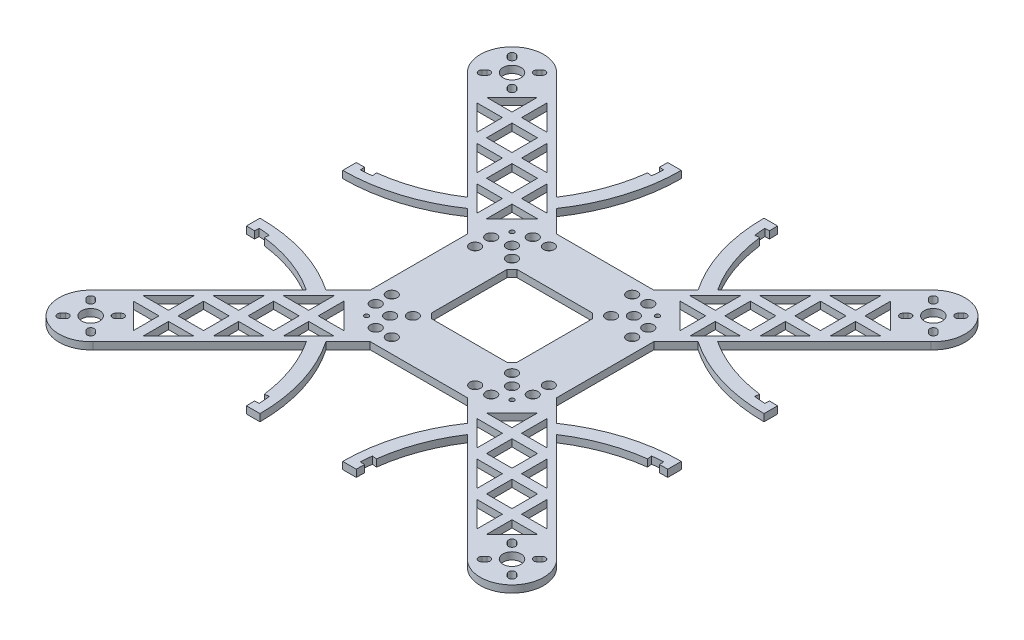
from build123d import *

# Parameters (mm, degrees)
SKETCH1_W                              = 82.58
SKETCH1_H                              = 82.58
CENTER_SQUARE_DEPTH                    = 3.175
SKETCH2_W                              = 37.87
SKETCH2_H                              = 37.87
SQUARE_HOLE_DEPTH                      = 3.175
SKETCH3_R                              = 2.375
POWER_BOARD_MOUNTING_HOLES_DEPTH       = 3.175
SQUARE_HOLE_DIAGONALS_DEPTH            = 3.175
SKETCH5_R                              = 1
ELECTRONICS_BOARD_MOUNTING_HOLES_DEPTH = 59.479131534
SKETCH6_R                              = 2.375
IR_SENSOR_MOUNTING_HOLES_DEPTH         = 59.479131534
PROPELLER_ARMS_DEPTH                   = 3.175
SKETCH8_R                              = 4
MOTOR_MOUNTING_HOLES_DEPTH             = 152.812368981
SKETCH10_W                             = 11.289276357
SKETCH10_H                             = 11.289276357
ARM_CROSS_HATCHING_DEPTH               = 152.812368981
GUARD_RINGS_DEPTH                      = 3.175


with BuildPart() as part:
    # Sketch1 → Center Square (new body)
    with BuildSketch(Plane(origin=(0, 0, 0), x_dir=(1, 0, 0), z_dir=(0, 1, 0))):
        Rectangle(SKETCH1_W, SKETCH1_H)
    extrude(amount=CENTER_SQUARE_DEPTH)

    # Sketch2 → Square Hole (cut)
    with BuildSketch(Plane(origin=(0, 3.175, 0), x_dir=(1, 0, 0), z_dir=(0, 1, 0))):
        Rectangle(SKETCH2_W, SKETCH2_H)
    extrude(amount=-SQUARE_HOLE_DEPTH, mode=Mode.SUBTRACT)

    # Sketch3 → Power Board Mounting Holes (cut)
    with BuildSketch(Plane(origin=(0, 3.175, 0), x_dir=(1, 0, 0), z_dir=(0, 1, 0))):
        with Locations(Location((21.955, 21.955, 0), (0, 0, 270))):
            Circle(SKETCH3_R)
        with Locations(Location((26.993135816, 26.993135816, 0), (0, 0, 270))):
            Circle(SKETCH3_R)
        with Locations(Location((21.955, -21.955, 0), (0, 0, 270))):
            Circle(SKETCH3_R)
        with Locations(Location((26.993135816, -26.993135816, 0), (0, 0, 270))):
            Circle(SKETCH3_R)
        with Locations(Location((-21.955, -21.955, 0), (0, 0, 270))):
            Circle(SKETCH3_R)
        with Locations(Location((-26.993135816, -26.993135816, 0), (0, 0, 270))):
            Circle(SKETCH3_R)
        with Locations(Location((-21.955, 21.955, 0), (0, 0, 270))):
            Circle(SKETCH3_R)
        with Locations(Location((-26.993135816, 26.993135816, 0), (0, 0, 270))):
            Circle(SKETCH3_R)
    extrude(amount=-POWER_BOARD_MOUNTING_HOLES_DEPTH, mode=Mode.SUBTRACT)

    # Sketch4 → Square Hole Diagonals (add)
    with BuildSketch(Plane(origin=(0, 3.175, 0), x_dir=(1, 0, 0), z_dir=(0, 1, 0))):
        Polygon((16.68993597, 18.935), (18.935, 16.68993597), (18.935, 18.935), align=None)
        Polygon((18.935, -16.68993597), (16.68993597, -18.935), (18.935, -18.935), align=None)
        Polygon((-16.68993597, -18.935), (-18.935, -16.68993597), (-18.935, -18.935), align=None)
        Polygon((-18.935, 16.68993597), (-16.68993597, 18.935), (-18.935, 18.935), align=None)
    extrude(amount=-SQUARE_HOLE_DIAGONALS_DEPTH)

    # Sketch5 → Electronics Board Mounting Holes (cut, through all)
    with BuildSketch(Plane(origin=(0, 3.175, 0), x_dir=(1, 0, 0), z_dir=(0, 1, 0))):
        with Locations(Location((32.22, 32.22, 0), (0, 0, 270))):
            Circle(SKETCH5_R)
        with Locations(Location((32.22, -32.22, 0), (0, 0, 270))):
            Circle(SKETCH5_R)
        with Locations(Location((-32.22, -32.22, 0), (0, 0, 270))):
            Circle(SKETCH5_R)
        with Locations(Location((-32.22, 32.22, 0), (0, 0, 270))):
            Circle(SKETCH5_R)
    extrude(amount=-ELECTRONICS_BOARD_MOUNTING_HOLES_DEPTH, mode=Mode.SUBTRACT)

    # Sketch6 → IR Sensor Mounting Holes (cut, through all)
    with BuildSketch(Plane(origin=(0, 3.175, 0), x_dir=(1, 0, 0), z_dir=(0, 1, 0))):
        with Locations(Location((34.79, 18.46, 0), (0, 0, 270))):
            Circle(SKETCH6_R)
        with Locations(Location((34.79, 25.585, 0), (0, 0, 270))):
            Circle(SKETCH6_R)
        with Locations(Location((34.79, -25.585, 0), (0, 0, 90))):
            Circle(SKETCH6_R)
        with Locations(Location((34.79, -18.46, 0), (0, 0, 90))):
            Circle(SKETCH6_R)
        with Locations(Location((25.585, -34.79, 0), (0, 0, 270))):
            Circle(SKETCH6_R)
        with Locations(Location((18.46, -34.79, 0), (0, 0, 270))):
            Circle(SKETCH6_R)
        with Locations(Location((-18.46, -34.79, 0), (0, 0, 90))):
            Circle(SKETCH6_R)
        with Locations(Location((-25.585, -34.79, 0), (0, 0, 90))):
            Circle(SKETCH6_R)
        with Locations(Location((-34.79, -25.585, 0), (0, 0, 270))):
            Circle(SKETCH6_R)
        with Locations(Location((-34.79, -18.46, 0), (0, 0, 270))):
            Circle(SKETCH6_R)
        with Locations(Location((-34.79, 18.46, 0), (0, 0, 90))):
            Circle(SKETCH6_R)
        with Locations(Location((-34.79, 25.585, 0), (0, 0, 90))):
            Circle(SKETCH6_R)
        with Locations(Location((-25.585, 34.79, 0), (0, 0, 270))):
            Circle(SKETCH6_R)
        with Locations(Location((-18.46, 34.79, 0), (0, 0, 270))):
            Circle(SKETCH6_R)
        with Locations(Location((18.46, 34.79, 0), (0, 0, 90))):
            Circle(SKETCH6_R)
        with Locations(Location((25.585, 34.79, 0), (0, 0, 90))):
            Circle(SKETCH6_R)
    extrude(amount=-IR_SENSOR_MOUNTING_HOLES_DEPTH, mode=Mode.SUBTRACT)

    # Sketch7 → Propeller Arms (add)
    with BuildSketch(Plane(origin=(0, 3.175, 0), x_dir=(1, 0, 0), z_dir=(0, 1, 0))):
        with BuildLine():
            Line((82.94515068, 102.719708411), (21.515442268, 41.29))
            Line((21.515442268, 41.29), (41.29, 41.29))
            Line((41.29, 41.29), (41.29, 21.515442268))
            Line((41.29, 21.515442268), (102.719708411, 82.94515068))
            ThreePointArc((102.719708411, 82.94515068), (103.223571337, 103.223571337), (82.94515068, 102.719708411))
        make_face()
        with BuildLine():
            Line((102.719708411, -82.94515068), (41.29, -21.515442268))
            Line((41.29, -21.515442268), (41.29, -41.29))
            Line((41.29, -41.29), (21.515442268, -41.29))
            Line((21.515442268, -41.29), (82.94515068, -102.719708411))
            ThreePointArc((82.94515068, -102.719708411), (103.223571337, -103.223571337), (102.719708411, -82.94515068))
        make_face()
        with BuildLine():
            Line((-82.94515068, -102.719708411), (-21.515442268, -41.29))
            Line((-21.515442268, -41.29), (-41.29, -41.29))
            Line((-41.29, -41.29), (-41.29, -21.515442268))
            Line((-41.29, -21.515442268), (-102.719708411, -82.94515068))
            ThreePointArc((-102.719708411, -82.94515068), (-103.223571337, -103.223571337), (-82.94515068, -102.719708411))
        make_face()
        with BuildLine():
            Line((-102.719708411, 82.94515068), (-41.29, 21.515442268))
            Line((-41.29, 21.515442268), (-41.29, 41.29))
            Line((-41.29, 41.29), (-21.515442268, 41.29))
            Line((-21.515442268, 41.29), (-82.94515068, 102.719708411))
            ThreePointArc((-82.94515068, 102.719708411), (-103.223571337, 103.223571337), (-102.719708411, 82.94515068))
        make_face()
    extrude(amount=-PROPELLER_ARMS_DEPTH)

    # Sketch8 → Motor Mounting Holes (cut, through all)
    with BuildSketch(Plane(origin=(0, 3.175, 0), x_dir=(1, 0, 0), z_dir=(0, 1, 0))):
        with Locations(Location((93.324076401, 93.324076401, 0), (0, 0, 270))):
            Circle(SKETCH8_R)
        with Locations(Location((93.324076401, -93.324076401, 0), (0, 0, 270))):
            Circle(SKETCH8_R)
        with Locations(Location((-93.324076401, -93.324076401, 0), (0, 0, 270))):
            Circle(SKETCH8_R)
        with Locations(Location((-93.324076401, 93.324076401, 0), (0, 0, 270))):
            Circle(SKETCH8_R)
        with BuildLine():
            Line((97.8495598, 99.970880144), (98.910219972, 101.031540316))
            ThreePointArc((98.910219972, 101.031540316), (101.031540316, 101.031540316), (101.031540316, 98.910219972))
            Line((101.031540316, 98.910219972), (99.970880144, 97.8495598))
            ThreePointArc((99.970880144, 97.8495598), (97.8495598, 97.8495598), (97.8495598, 99.970880144))
        make_face()
        with BuildLine():
            Line((99.970880144, 88.798593001), (101.031540316, 87.737932829))
            ThreePointArc((101.031540316, 87.737932829), (101.031540316, 85.616612486), (98.910219972, 85.616612486))
            Line((98.910219972, 85.616612486), (97.8495598, 86.677272658))
            ThreePointArc((97.8495598, 86.677272658), (97.8495598, 88.798593001), (99.970880144, 88.798593001))
        make_face()
        with BuildLine():
            Line((88.798593001, 86.677272658), (87.737932829, 85.616612486))
            ThreePointArc((87.737932829, 85.616612486), (85.616612486, 85.616612486), (85.616612486, 87.737932829))
            Line((85.616612486, 87.737932829), (86.677272658, 88.798593001))
            ThreePointArc((86.677272658, 88.798593001), (88.798593001, 88.798593001), (88.798593001, 86.677272658))
        make_face()
        with BuildLine():
            Line((86.677272658, 97.8495598), (85.616612486, 98.910219972))
            ThreePointArc((85.616612486, 98.910219972), (85.616612486, 101.031540316), (87.737932829, 101.031540316))
            Line((87.737932829, 101.031540316), (88.798593001, 99.970880144))
            ThreePointArc((88.798593001, 99.970880144), (88.798593001, 97.8495598), (86.677272658, 97.8495598))
        make_face()
        with BuildLine():
            Line((99.970880144, -97.8495598), (101.031540316, -98.910219972))
            ThreePointArc((101.031540316, -98.910219972), (101.031540316, -101.031540316), (98.910219972, -101.031540316))
            Line((98.910219972, -101.031540316), (97.8495598, -99.970880144))
            ThreePointArc((97.8495598, -99.970880144), (97.8495598, -97.8495598), (99.970880144, -97.8495598))
        make_face()
        with BuildLine():
            Line((88.798593001, -99.970880144), (87.737932829, -101.031540316))
            ThreePointArc((87.737932829, -101.031540316), (85.616612486, -101.031540316), (85.616612486, -98.910219972))
            Line((85.616612486, -98.910219972), (86.677272658, -97.8495598))
            ThreePointArc((86.677272658, -97.8495598), (88.798593001, -97.8495598), (88.798593001, -99.970880144))
        make_face()
        with BuildLine():
            Line((86.677272658, -88.798593001), (85.616612486, -87.737932829))
            ThreePointArc((85.616612486, -87.737932829), (85.616612486, -85.616612486), (87.737932829, -85.616612486))
            Line((87.737932829, -85.616612486), (88.798593001, -86.677272658))
            ThreePointArc((88.798593001, -86.677272658), (88.798593001, -88.798593001), (86.677272658, -88.798593001))
        make_face()
        with BuildLine():
            Line((97.8495598, -86.677272658), (98.910219972, -85.616612486))
            ThreePointArc((98.910219972, -85.616612486), (101.031540316, -85.616612486), (101.031540316, -87.737932829))
            Line((101.031540316, -87.737932829), (99.970880144, -88.798593001))
            ThreePointArc((99.970880144, -88.798593001), (97.8495598, -88.798593001), (97.8495598, -86.677272658))
        make_face()
        with BuildLine():
            Line((-97.8495598, -99.970880144), (-98.910219972, -101.031540316))
            ThreePointArc((-98.910219972, -101.031540316), (-101.031540316, -101.031540316), (-101.031540316, -98.910219972))
            Line((-101.031540316, -98.910219972), (-99.970880144, -97.8495598))
            ThreePointArc((-99.970880144, -97.8495598), (-97.8495598, -97.8495598), (-97.8495598, -99.970880144))
        make_face()
        with BuildLine():
            Line((-99.970880144, -88.798593001), (-101.031540316, -87.737932829))
            ThreePointArc((-101.031540316, -87.737932829), (-101.031540316, -85.616612486), (-98.910219972, -85.616612486))
            Line((-98.910219972, -85.616612486), (-97.8495598, -86.677272658))
            ThreePointArc((-97.8495598, -86.677272658), (-97.8495598, -88.798593001), (-99.970880144, -88.798593001))
        make_face()
        with BuildLine():
            Line((-88.798593001, -86.677272658), (-87.737932829, -85.616612486))
            ThreePointArc((-87.737932829, -85.616612486), (-85.616612486, -85.616612486), (-85.616612486, -87.737932829))
            Line((-85.616612486, -87.737932829), (-86.677272658, -88.798593001))
            ThreePointArc((-86.677272658, -88.798593001), (-88.798593001, -88.798593001), (-88.798593001, -86.677272658))
        make_face()
        with BuildLine():
            Line((-86.677272658, -97.8495598), (-85.616612486, -98.910219972))
            ThreePointArc((-85.616612486, -98.910219972), (-85.616612486, -101.031540316), (-87.737932829, -101.031540316))
            Line((-87.737932829, -101.031540316), (-88.798593001, -99.970880144))
            ThreePointArc((-88.798593001, -99.970880144), (-88.798593001, -97.8495598), (-86.677272658, -97.8495598))
        make_face()
        with BuildLine():
            Line((-99.970880144, 97.8495598), (-101.031540316, 98.910219972))
            ThreePointArc((-101.031540316, 98.910219972), (-101.031540316, 101.031540316), (-98.910219972, 101.031540316))
            Line((-98.910219972, 101.031540316), (-97.8495598, 99.970880144))
            ThreePointArc((-97.8495598, 99.970880144), (-97.8495598, 97.8495598), (-99.970880144, 97.8495598))
        make_face()
        with BuildLine():
            Line((-88.798593001, 99.970880144), (-87.737932829, 101.031540316))
            ThreePointArc((-87.737932829, 101.031540316), (-85.616612486, 101.031540316), (-85.616612486, 98.910219972))
            Line((-85.616612486, 98.910219972), (-86.677272658, 97.8495598))
            ThreePointArc((-86.677272658, 97.8495598), (-88.798593001, 97.8495598), (-88.798593001, 99.970880144))
        make_face()
        with BuildLine():
            Line((-86.677272658, 88.798593001), (-85.616612486, 87.737932829))
            ThreePointArc((-85.616612486, 87.737932829), (-85.616612486, 85.616612486), (-87.737932829, 85.616612486))
            Line((-87.737932829, 85.616612486), (-88.798593001, 86.677272658))
            ThreePointArc((-88.798593001, 86.677272658), (-88.798593001, 88.798593001), (-86.677272658, 88.798593001))
        make_face()
        with BuildLine():
            Line((-97.8495598, 86.677272658), (-98.910219972, 85.616612486))
            ThreePointArc((-98.910219972, 85.616612486), (-101.031540316, 85.616612486), (-101.031540316, 87.737932829))
            Line((-101.031540316, 87.737932829), (-99.970880144, 88.798593001))
            ThreePointArc((-99.970880144, 88.798593001), (-97.8495598, 88.798593001), (-97.8495598, 86.677272658))
        make_face()
    extrude(amount=-MOTOR_MOUNTING_HOLES_DEPTH, mode=Mode.SUBTRACT)

    # Sketch10 → Arm Cross-Hatching (cut, through all)
    with BuildSketch(Plane(origin=(0, 3.175, 0), x_dir=(1, 0, 0), z_dir=(0, 1, 0))):
        Polygon((31.613497637, 42.902773995), (42.902773995, 31.613497637), (42.902773995, 42.902773995), align=None)
        Polygon((42.902773995, 47.148412406), (42.902773995, 58.437688763), (31.613497637, 47.148412406), align=None)
        with Locations((52.793050585, 52.793050585)):
            Rectangle(SKETCH10_W, SKETCH10_H)
        Polygon((47.148412406, 42.902773995), (47.148412406, 31.613497637), (58.437688763, 42.902773995), align=None)
        Polygon((58.432773995, 62.678412406), (58.432773995, 73.967688763), (47.143497637, 62.678412406), align=None)
        with Locations((68.323050585, 68.323050585)):
            Rectangle(SKETCH10_W, SKETCH10_H)
        Polygon((73.967688763, 58.432773995), (62.678412406, 58.432773995), (62.678412406, 47.143497637), align=None)
        Polygon((73.962773995, 78.208412406), (73.962773995, 89.497688763), (62.673497637, 78.208412406), align=None)
        Polygon((78.208412406, 89.497688763), (78.208412406, 78.208412406), (89.497688763, 78.208412406), align=None)
        Polygon((42.902773995, -31.613497637), (31.613497637, -42.902773995), (42.902773995, -42.902773995), align=None)
        Polygon((89.497688763, 73.962773995), (78.208412406, 73.962773995), (78.208412406, 62.673497637), align=None)
        Polygon((47.148412406, -42.902773995), (58.437688763, -42.902773995), (47.148412406, -31.613497637), align=None)
        with Locations((52.793050585, -52.793050585)):
            Rectangle(SKETCH10_W, SKETCH10_H)
        Polygon((42.902773995, -47.148412406), (31.613497637, -47.148412406), (42.902773995, -58.437688763), align=None)
        Polygon((62.678412406, -58.432773995), (73.967688763, -58.432773995), (62.678412406, -47.143497637), align=None)
        with Locations((68.323050585, -68.323050585)):
            Rectangle(SKETCH10_W, SKETCH10_H)
        Polygon((58.432773995, -73.967688763), (58.432773995, -62.678412406), (47.143497637, -62.678412406), align=None)
        Polygon((78.208412406, -73.962773995), (89.497688763, -73.962773995), (78.208412406, -62.673497637), align=None)
        Polygon((89.497688763, -78.208412406), (78.208412406, -78.208412406), (78.208412406, -89.497688763), align=None)
        Polygon((73.962773995, -89.497688763), (73.962773995, -78.208412406), (62.673497637, -78.208412406), align=None)
        Polygon((-31.613497637, -42.902773995), (-42.902773995, -31.613497637), (-42.902773995, -42.902773995), align=None)
        Polygon((-42.902773995, -47.148412406), (-42.902773995, -58.437688763), (-31.613497637, -47.148412406), align=None)
        with Locations((-52.793050585, -52.793050585)):
            Rectangle(SKETCH10_W, SKETCH10_H)
        Polygon((-47.148412406, -42.902773995), (-47.148412406, -31.613497637), (-58.437688763, -42.902773995), align=None)
        Polygon((-58.432773995, -62.678412406), (-58.432773995, -73.967688763), (-47.143497637, -62.678412406), align=None)
        with Locations((-68.323050585, -68.323050585)):
            Rectangle(SKETCH10_W, SKETCH10_H)
        Polygon((-73.967688763, -58.432773995), (-62.678412406, -58.432773995), (-62.678412406, -47.143497637), align=None)
        Polygon((-73.962773995, -78.208412406), (-73.962773995, -89.497688763), (-62.673497637, -78.208412406), align=None)
        Polygon((-78.208412406, -89.497688763), (-78.208412406, -78.208412406), (-89.497688763, -78.208412406), align=None)
        Polygon((-89.497688763, -73.962773995), (-78.208412406, -73.962773995), (-78.208412406, -62.673497637), align=None)
        Polygon((-42.902773995, 31.613497637), (-31.613497637, 42.902773995), (-42.902773995, 42.902773995), align=None)
        Polygon((-47.148412406, 42.902773995), (-58.437688763, 42.902773995), (-47.148412406, 31.613497637), align=None)
        with Locations((-52.793050585, 52.793050585)):
            Rectangle(SKETCH10_W, SKETCH10_H)
        Polygon((-42.902773995, 47.148412406), (-31.613497637, 47.148412406), (-42.902773995, 58.437688763), align=None)
        Polygon((-62.678412406, 58.432773995), (-73.967688763, 58.432773995), (-62.678412406, 47.143497637), align=None)
        with Locations((-68.323050585, 68.323050585)):
            Rectangle(SKETCH10_W, SKETCH10_H)
        Polygon((-58.432773995, 73.967688763), (-58.432773995, 62.678412406), (-47.143497637, 62.678412406), align=None)
        Polygon((-78.208412406, 73.962773995), (-89.497688763, 73.962773995), (-78.208412406, 62.673497637), align=None)
        Polygon((-89.497688763, 78.208412406), (-78.208412406, 78.208412406), (-78.208412406, 89.497688763), align=None)
        Polygon((-73.962773995, 89.497688763), (-73.962773995, 78.208412406), (-62.673497637, 78.208412406), align=None)
    extrude(amount=-ARM_CROSS_HATCHING_DEPTH, mode=Mode.SUBTRACT)

    # Sketch11 → Guard Rings (add)
    with BuildSketch(Plane(origin=(0, 3.175, 0), x_dir=(1, 0, 0), z_dir=(0, 1, 0))):
        with BuildLine():
            Line((18.324076401, 93.324076401), (24.324076401, 93.324076401))
            ThreePointArc((24.324076401, 93.324076401), (24.347720978, 91.517866968), (24.418638503, 89.71289542))
            Line((24.418638503, 89.71289542), (22.421379433, 89.608223508))
            ThreePointArc((22.421379433, 89.608223508), (22.594252836, 87.136018666), (22.853299634, 84.671353019))
            Line((22.853299634, 84.671353019), (24.838391938, 84.915091706))
            ThreePointArc((24.838391938, 84.915091706), (28.54897939, 69.550418559), (35.658751147, 55.433308879))
            Line((35.658751147, 55.433308879), (31.333614171, 51.108171903))
            ThreePointArc((31.333614171, 51.108171903), (21.65021552, 71.236576171), (18.324076401, 93.324076401))
        make_face()
        with BuildLine():
            Line((84.671353019, 22.853299634), (84.915091706, 24.838391938))
            ThreePointArc((84.915091706, 24.838391938), (69.550418559, 28.54897939), (55.433308879, 35.658751147))
            Line((55.433308879, 35.658751147), (51.108171903, 31.333614171))
            ThreePointArc((51.108171903, 31.333614171), (71.236576171, 21.65021552), (93.324076401, 18.324076401))
            Line((93.324076401, 18.324076401), (93.324076401, 24.324076401))
            ThreePointArc((93.324076401, 24.324076401), (91.517866968, 24.347720978), (89.71289542, 24.418638503))
            Line((89.71289542, 24.418638503), (89.608223508, 22.421379433))
            ThreePointArc((89.608223508, 22.421379433), (87.136018666, 22.594252836), (84.671353019, 22.853299634))
        make_face()
        with BuildLine():
            Line((93.324076401, -18.324076401), (93.324076401, -24.324076401))
            ThreePointArc((93.324076401, -24.324076401), (91.517866968, -24.347720978), (89.71289542, -24.418638503))
            Line((89.71289542, -24.418638503), (89.608223508, -22.421379433))
            ThreePointArc((89.608223508, -22.421379433), (87.136018666, -22.594252836), (84.671353019, -22.853299634))
            Line((84.671353019, -22.853299634), (84.915091706, -24.838391938))
            ThreePointArc((84.915091706, -24.838391938), (69.550418559, -28.54897939), (55.433308879, -35.658751147))
            Line((55.433308879, -35.658751147), (51.108171903, -31.333614171))
            ThreePointArc((51.108171903, -31.333614171), (71.236576171, -21.65021552), (93.324076401, -18.324076401))
        make_face()
        with BuildLine():
            Line((22.853299634, -84.671353019), (24.838391938, -84.915091706))
            ThreePointArc((24.838391938, -84.915091706), (28.54897939, -69.550418559), (35.658751147, -55.433308879))
            Line((35.658751147, -55.433308879), (31.333614171, -51.108171903))
            ThreePointArc((31.333614171, -51.108171903), (21.65021552, -71.236576171), (18.324076401, -93.324076401))
            Line((18.324076401, -93.324076401), (24.324076401, -93.324076401))
            ThreePointArc((24.324076401, -93.324076401), (24.347720978, -91.517866968), (24.418638503, -89.71289542))
            Line((24.418638503, -89.71289542), (22.421379433, -89.608223508))
            ThreePointArc((22.421379433, -89.608223508), (22.594252836, -87.136018666), (22.853299634, -84.671353019))
        make_face()
        with BuildLine():
            Line((-18.324076401, -93.324076401), (-24.324076401, -93.324076401))
            ThreePointArc((-24.324076401, -93.324076401), (-24.347720978, -91.517866968), (-24.418638503, -89.71289542))
            Line((-24.418638503, -89.71289542), (-22.421379433, -89.608223508))
            ThreePointArc((-22.421379433, -89.608223508), (-22.594252836, -87.136018666), (-22.853299634, -84.671353019))
            Line((-22.853299634, -84.671353019), (-24.838391938, -84.915091706))
            ThreePointArc((-24.838391938, -84.915091706), (-28.54897939, -69.550418559), (-35.658751147, -55.433308879))
            Line((-35.658751147, -55.433308879), (-31.333614171, -51.108171903))
            ThreePointArc((-31.333614171, -51.108171903), (-21.65021552, -71.236576171), (-18.324076401, -93.324076401))
        make_face()
        with BuildLine():
            Line((-84.671353019, -22.853299634), (-84.915091706, -24.838391938))
            ThreePointArc((-84.915091706, -24.838391938), (-69.550418559, -28.54897939), (-55.433308879, -35.658751147))
            Line((-55.433308879, -35.658751147), (-51.108171903, -31.333614171))
            ThreePointArc((-51.108171903, -31.333614171), (-71.236576171, -21.65021552), (-93.324076401, -18.324076401))
            Line((-93.324076401, -18.324076401), (-93.324076401, -24.324076401))
            ThreePointArc((-93.324076401, -24.324076401), (-91.517866968, -24.347720978), (-89.71289542, -24.418638503))
            Line((-89.71289542, -24.418638503), (-89.608223508, -22.421379433))
            ThreePointArc((-89.608223508, -22.421379433), (-87.136018666, -22.594252836), (-84.671353019, -22.853299634))
        make_face()
        with BuildLine():
            Line((-93.324076401, 18.324076401), (-93.324076401, 24.324076401))
            ThreePointArc((-93.324076401, 24.324076401), (-91.517866968, 24.347720978), (-89.71289542, 24.418638503))
            Line((-89.71289542, 24.418638503), (-89.608223508, 22.421379433))
            ThreePointArc((-89.608223508, 22.421379433), (-87.136018666, 22.594252836), (-84.671353019, 22.853299634))
            Line((-84.671353019, 22.853299634), (-84.915091706, 24.838391938))
            ThreePointArc((-84.915091706, 24.838391938), (-69.550418559, 28.54897939), (-55.433308879, 35.658751147))
            Line((-55.433308879, 35.658751147), (-51.108171903, 31.333614171))
            ThreePointArc((-51.108171903, 31.333614171), (-71.236576171, 21.65021552), (-93.324076401, 18.324076401))
        make_face()
        with BuildLine():
            Line((-22.853299634, 84.671353019), (-24.838391938, 84.915091706))
            ThreePointArc((-24.838391938, 84.915091706), (-28.54897939, 69.550418559), (-35.658751147, 55.433308879))
            Line((-35.658751147, 55.433308879), (-31.333614171, 51.108171903))
            ThreePointArc((-31.333614171, 51.108171903), (-21.65021552, 71.236576171), (-18.324076401, 93.324076401))
            Line((-18.324076401, 93.324076401), (-24.324076401, 93.324076401))
            ThreePointArc((-24.324076401, 93.324076401), (-24.347720978, 91.517866968), (-24.418638503, 89.71289542))
            Line((-24.418638503, 89.71289542), (-22.421379433, 89.608223508))
            ThreePointArc((-22.421379433, 89.608223508), (-22.594252836, 87.136018666), (-22.853299634, 84.671353019))
        make_face()
    extrude(amount=-GUARD_RINGS_DEPTH)


solid = part.part
